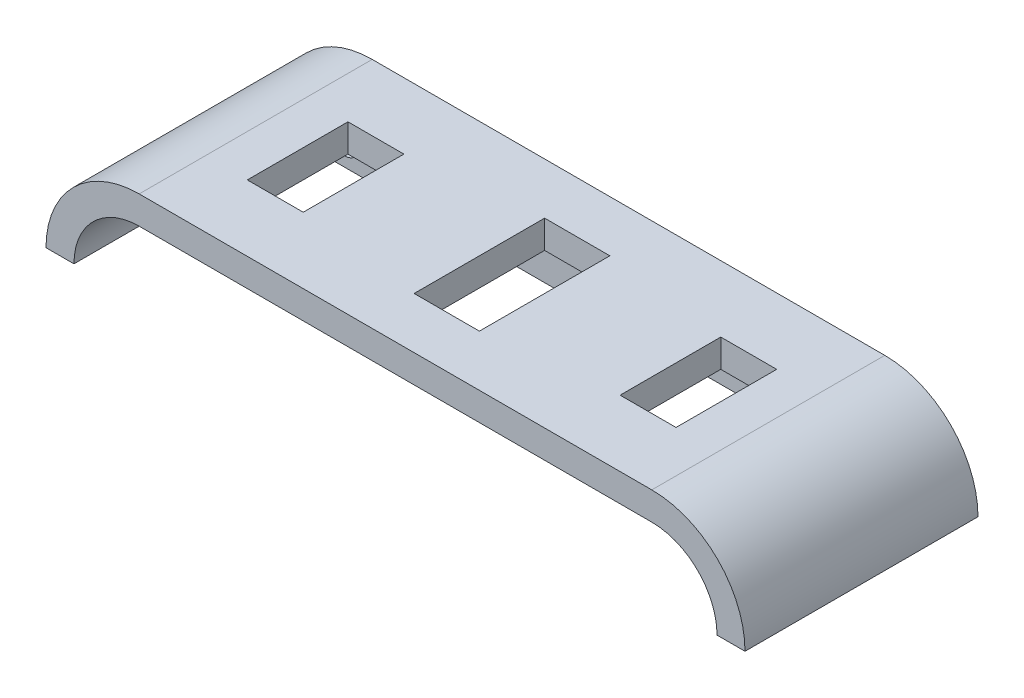
from build123d import *

# Parameters (mm, degrees)
BOSS_EXTRU_1_DEPTH      = 25
BOSS_EXTRU_2_DEPTH      = 3
ESQUISSE5_W             = 6
ESQUISSE5_H             = 10.8
ESQUISSE5_W_2           = 7
ESQUISSE5_H_2           = 14
ENL_V_MAT_EXTRU_1_DEPTH = 13
ESQUISSE6_R             = 1.7
ENL_V_MAT_EXTRU_2_DEPTH = 13


with BuildPart() as part:
    # Esquisse1 → Boss.-Extru.1 (new body)
    with BuildSketch(Plane.XY):
        with BuildLine():
            Line((-54.225217391, 16.453664596), (0.774782609, 16.453664596))
            ThreePointArc((0.774782609, 16.453664596), (7.845850421, 13.524732408), (10.774782609, 6.453664596))
            Line((10.774782609, 6.453664596), (7.774782609, 6.453664596))
            ThreePointArc((7.774782609, 6.453664596), (5.724530077, 11.403412065), (0.774782609, 13.453664596))
            Line((0.774782609, 13.453664596), (-54.225217391, 13.453664596))
            ThreePointArc((-54.225217391, 13.453664596), (-59.17496486, 11.403412065), (-61.225217391, 6.453664596))
            Line((-61.225217391, 6.453664596), (-64.225217391, 6.453664596))
            ThreePointArc((-64.225217391, 6.453664596), (-61.296285203, 13.524732408), (-54.225217391, 16.453664596))
        make_face()
    extrude(amount=BOSS_EXTRU_1_DEPTH)

    # Esquisse3 → Boss.-Extru.2 (add)
    with BuildSketch(Plane.XY):
        with BuildLine():
            Line((-61.062614557, 7.953664596), (7.612179774, 7.953664596))
            ThreePointArc((7.612179774, 7.953664596), (5.162264802, 11.908020654), (0.774782609, 13.453664596))
            Line((0.774782609, 13.453664596), (-54.225217391, 13.453664596))
            ThreePointArc((-54.225217391, 13.453664596), (-58.612699585, 11.908020654), (-61.062614557, 7.953664596))
        make_face()
    extrude(amount=BOSS_EXTRU_2_DEPTH)

    # Esquisse5 → Enlèv. mat.-Extru.1 (cut)
    with BuildSketch(Plane(origin=(0, 16.453664596, 0), x_dir=(1, 0, 0), z_dir=(0, 1, 0))):
        with Locations((-46.725217391, -12.5)):
            Rectangle(ESQUISSE5_W, ESQUISSE5_H)
        with Locations((-6.725217391, -12.5)):
            Rectangle(ESQUISSE5_W, ESQUISSE5_H)
        with Locations((-26.725217391, -12.5)):
            Rectangle(ESQUISSE5_W_2, ESQUISSE5_H_2)
    extrude(amount=-ENL_V_MAT_EXTRU_1_DEPTH, mode=Mode.SUBTRACT)

    # Esquisse6 → Enlèv. mat.-Extru.2 (cut)
    with BuildSketch(Plane(origin=(0, 0, 0), x_dir=(-1, 0, 0), z_dir=(0, 0, -1))):
        with Locations((-0.774782609, 10.703664596)):
            Circle(ESQUISSE6_R)
        with Locations((26.725217391, 10.703664596)):
            Circle(ESQUISSE6_R)
        with Locations((54.225217391, 10.703664596)):
            Circle(ESQUISSE6_R)
    extrude(amount=-ENL_V_MAT_EXTRU_2_DEPTH, mode=Mode.SUBTRACT)


solid = part.part
